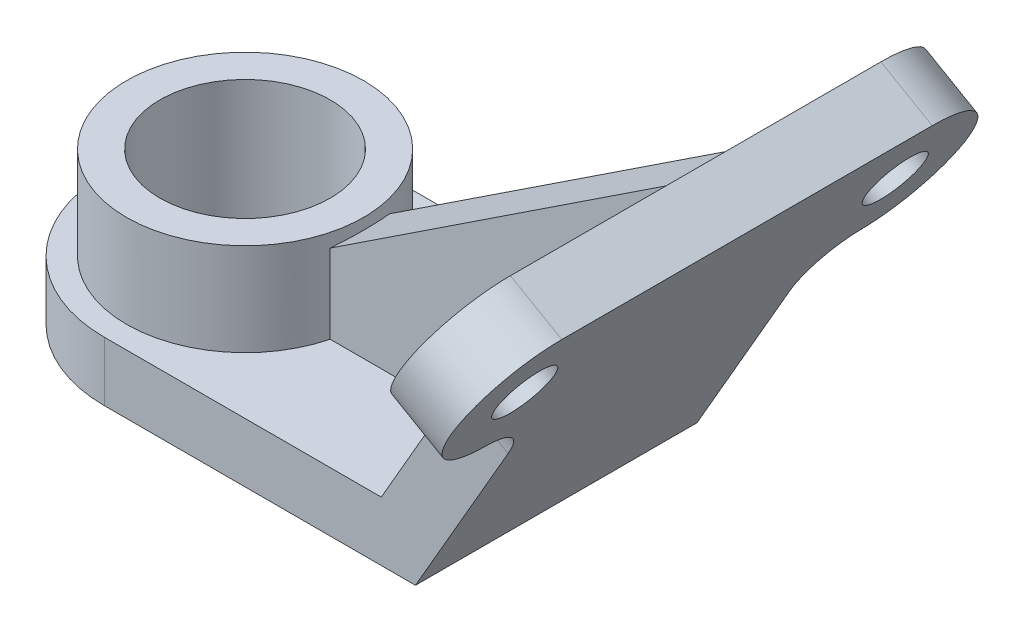
from build123d import *

# Parameters (mm, degrees)
SKETCH_1_R      = 32
EXTRUDE_1_DEPTH = 16
SKETCH_1_3_R    = 32
SKETCH_1_3_R_2  = 23
EXTRUDE_2_DEPTH = 41
SKETCH_3_R      = 8
EXTRUDE_3_DEPTH = 16
RIB_1_REACH     = 182.854
SKETCH_4_WALL_W = 471.13581316
SKETCH_4_WALL_H = 16


with BuildPart() as part:
    # 草图1 → 凸台-拉伸1 (new body)
    with BuildSketch(Plane(origin=(0, 0, 0), x_dir=(1, 0, 0), z_dir=(0, 1, 0))):
        with BuildLine():
            Line((84, 38), (0, 38))
            ThreePointArc((0, 38), (-38, 0), (0, -38))
            Line((0, -38), (84, -38))
            Line((84, -38), (84, 38))
        make_face()
        Circle(SKETCH_1_R, mode=Mode.SUBTRACT)
    extrude(amount=EXTRUDE_1_DEPTH)

    # 草图1<3> → 凸台-拉伸2 (add)
    with BuildSketch(Plane(origin=(0, 0, 0), x_dir=(1, 0, 0), z_dir=(0, 1, 0))):
        Circle(SKETCH_1_3_R)
        Circle(SKETCH_1_3_R_2, mode=Mode.SUBTRACT)
    extrude(amount=EXTRUDE_2_DEPTH)

    # 草图3 → 凸台-拉伸3 (add)
    with BuildSketch(Plane(origin=(63, -36.373066959, 0), x_dir=(0, 0, 1), z_dir=(-0.8660254037844398, 0.499999999999998, 0))):
        with BuildLine():
            Line((-38, 42), (-38, 92))
            ThreePointArc((-38, 92), (-41.807611845, 101.192388155), (-51, 105))
            Line((-51, 105), (-50, 105))
            ThreePointArc((-50, 105), (-70, 125), (-50, 145))
            Line((-50, 145), (50, 145))
            ThreePointArc((50, 145), (70, 125), (50, 105))
            Line((50, 105), (51, 105))
            ThreePointArc((51, 105), (41.807611845, 101.192388155), (38, 92))
            Line((38, 92), (38, 42))
            Line((38, 42), (-38, 42))
        make_face()
        with Locations((-50, 125)):
            Circle(SKETCH_3_R, mode=Mode.SUBTRACT)
        with Locations((50, 125)):
            Circle(SKETCH_3_R, mode=Mode.SUBTRACT)
    extrude(amount=EXTRUDE_3_DEPTH)

    # 草图4 wall → 筋1 (add, up to next)
    with BuildSketch(Plane(origin=(76.821796769, 67.600308295, 0), x_dir=(-0.834455975571, -0.551074609136, 0), z_dir=(0.551074609136, -0.834455975571, 0)), mode=Mode.PRIVATE) as rib_1_sk1:
        Rectangle(SKETCH_4_WALL_W, SKETCH_4_WALL_H)
    rib_1_tool1 = extrude(rib_1_sk1.sketch, amount=RIB_1_REACH, mode=Mode.PRIVATE) - part.part
    add(rib_1_tool1.solids().sort_by_distance((76.821796769, 67.600308295, 0))[0])


solid = part.part
